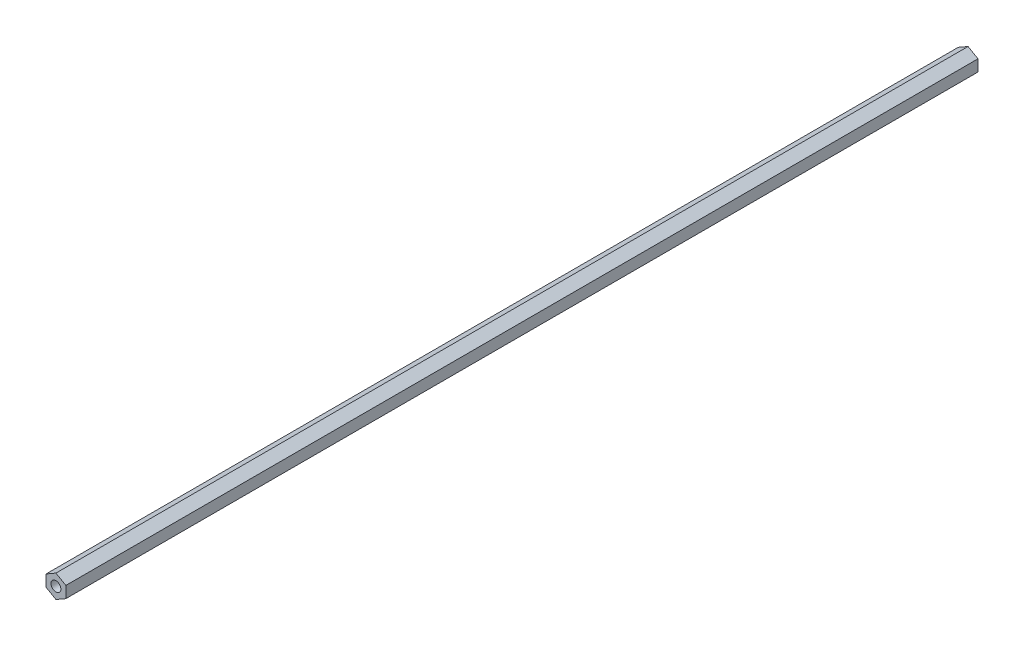
from build123d import *

# Parameters (mm, degrees)
BOSS_EXTRUDE2_DEPTH             = 292.1
BOSS_EXTRUDE2_DEPTH_BACK        = 292.1
F_1_4_0_25_DIAMETER_HOLE1_D     = 6.35
F_1_4_0_25_DIAMETER_HOLE1_DEPTH = 25.4
F_1_4_0_25_DIAMETER_HOLE1_TIP   = 1.907732465
F_1_4_0_25_DIAMETER_HOLE2_D     = 6.35
F_1_4_0_25_DIAMETER_HOLE2_DEPTH = 25.4
F_1_4_0_25_DIAMETER_HOLE2_TIP   = 1.907732465


with BuildPart() as part:
    # Sketch3 → Boss-Extrude2 (new, two sides: drawn at the far end of the back side and taken through both)
    with BuildSketch(Plane.XY.offset(-BOSS_EXTRUDE2_DEPTH_BACK)):
        Polygon((-6.35, -3.666174209), (0, -7.332348419), (6.35, -3.666174209), (6.35, 3.666174209), (0, 7.332348419), (-6.35, 3.666174209), align=None)
    extrude(amount=BOSS_EXTRUDE2_DEPTH + BOSS_EXTRUDE2_DEPTH_BACK)

    # 1/4 (0.25) Diameter Hole1
    with Locations(Plane.XY.offset(292.1)):
        with Locations((0, 0)):
            Hole(F_1_4_0_25_DIAMETER_HOLE1_D / 2, depth=F_1_4_0_25_DIAMETER_HOLE1_DEPTH)
            with Locations((0, 0, -(F_1_4_0_25_DIAMETER_HOLE1_DEPTH + F_1_4_0_25_DIAMETER_HOLE1_TIP / 2))):  # 118° drill point
                Cone(0, F_1_4_0_25_DIAMETER_HOLE1_D / 2, F_1_4_0_25_DIAMETER_HOLE1_TIP, mode=Mode.SUBTRACT)

    # 1/4 (0.25) Diameter Hole2
    with Locations(Plane(origin=(0, 0, -292.1), x_dir=(-1, 0, 0), z_dir=(0, 0, -1))):
        with Locations((0, 0)):
            Hole(F_1_4_0_25_DIAMETER_HOLE2_D / 2, depth=F_1_4_0_25_DIAMETER_HOLE2_DEPTH)
            with Locations((0, 0, -(F_1_4_0_25_DIAMETER_HOLE2_DEPTH + F_1_4_0_25_DIAMETER_HOLE2_TIP / 2))):  # 118° drill point
                Cone(0, F_1_4_0_25_DIAMETER_HOLE2_D / 2, F_1_4_0_25_DIAMETER_HOLE2_TIP, mode=Mode.SUBTRACT)


solid = part.part
